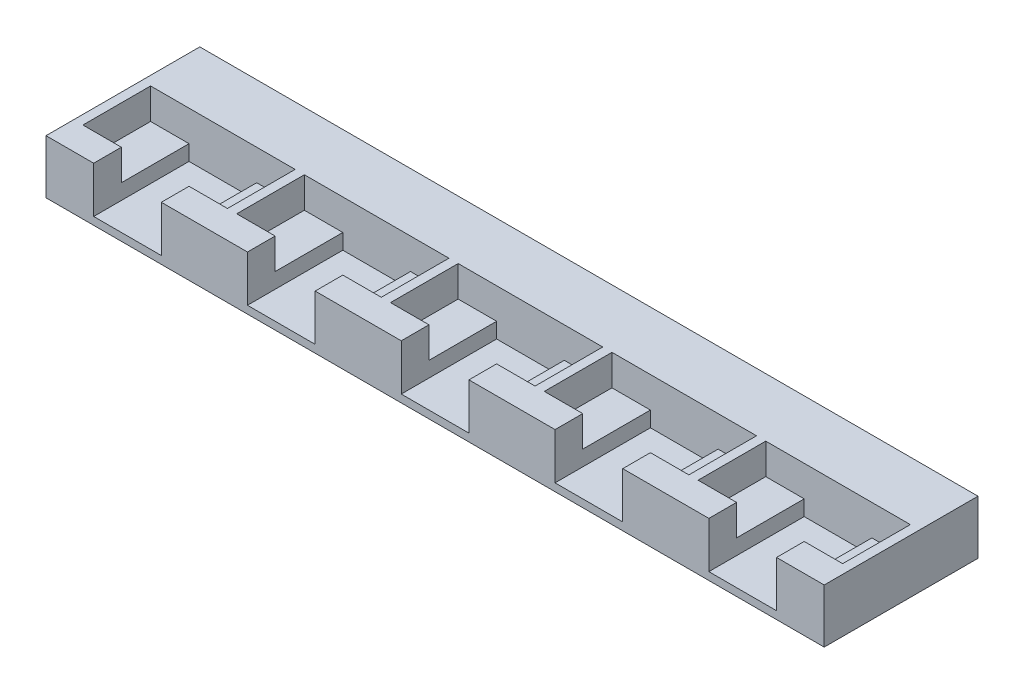
from build123d import *

# Parameters (mm, degrees)
SKETCH1_W               = 253
SKETCH1_H               = 50
BOSS_EXTRUDE1_DEPTH     = 17.5
SKETCH2_W               = 47
SKETCH2_H               = 22
CUT_EXTRUDE1_DEPTH      = 10
SKETCH4_W               = 22
SKETCH4_H               = 31
CUT_EXTRUDE2_DEPTH      = 15
MIRROR2_COPY_1_SKETCH_W = 47
MIRROR2_COPY_1_SKETCH_H = 22
MIRROR2_COPY_1_DEPTH    = 10
MIRROR2_COPY_2_SKETCH_W = 22
MIRROR2_COPY_2_SKETCH_H = 31
MIRROR2_COPY_2_DEPTH    = 15


with BuildPart() as part:
    # Sketch1 → Boss-Extrude1 (new body)
    with BuildSketch(Plane(origin=(0, 0, 0), x_dir=(1, 0, 0), z_dir=(0, 1, 0))):
        with Locations((126.5, -10)):
            Rectangle(SKETCH1_W, SKETCH1_H)
    extrude(amount=BOSS_EXTRUDE1_DEPTH)

    # Sketch2 → Cut-Extrude1 (cut)
    with BuildSketch(Plane(origin=(0, 17.5, 0), x_dir=(1, 0, 0), z_dir=(0, 1, 0))):
        with Locations((26.5, -15)):
            Rectangle(SKETCH2_W, SKETCH2_H)
    cut_extrude1 = extrude(amount=-CUT_EXTRUDE1_DEPTH, mode=Mode.SUBTRACT)

    # Sketch4 → Cut-Extrude2 (cut)
    with BuildSketch(Plane(origin=(0, 17.5, 0), x_dir=(1, 0, 0), z_dir=(0, 1, 0))):
        with Locations((26.5, -19.5)):
            Rectangle(SKETCH4_W, SKETCH4_H)
    cut_extrude2 = extrude(amount=-CUT_EXTRUDE2_DEPTH, mode=Mode.SUBTRACT)

    # Mirror1: Cut-Extrude1, Cut-Extrude2 across plane
    add(cut_extrude1.mirror(Plane.ZY.offset(-51.5)), mode=Mode.SUBTRACT)
    add(cut_extrude2.mirror(Plane.ZY.offset(-51.5)), mode=Mode.SUBTRACT)

    # Mirror2: Cut-Extrude1, Cut-Extrude2 across plane
    add(cut_extrude1.mirror(Plane.ZY.offset(-101.5)), mode=Mode.SUBTRACT)
    add(cut_extrude2.mirror(Plane.ZY.offset(-101.5)), mode=Mode.SUBTRACT)

    # Mirror2 copy 1 sketch → Mirror2 copy 1 (cut)
    with BuildSketch(Plane(origin=(100, 17.5, 0), x_dir=(1, 0, 0), z_dir=(0, 1, 0))):
        with Locations((26.5, -15)):
            Rectangle(MIRROR2_COPY_1_SKETCH_W, MIRROR2_COPY_1_SKETCH_H)
    extrude(amount=-MIRROR2_COPY_1_DEPTH, mode=Mode.SUBTRACT)

    # Mirror2 copy 2 sketch → Mirror2 copy 2 (cut)
    with BuildSketch(Plane(origin=(100, 17.5, 0), x_dir=(1, 0, 0), z_dir=(0, 1, 0))):
        with Locations((26.5, -19.5)):
            Rectangle(MIRROR2_COPY_2_SKETCH_W, MIRROR2_COPY_2_SKETCH_H)
    extrude(amount=-MIRROR2_COPY_2_DEPTH, mode=Mode.SUBTRACT)

    # Mirror3: Cut-Extrude1, Cut-Extrude2 across plane
    add(cut_extrude1.mirror(Plane.ZY.offset(-126.5)), mode=Mode.SUBTRACT)
    add(cut_extrude2.mirror(Plane.ZY.offset(-126.5)), mode=Mode.SUBTRACT)


solid = part.part
